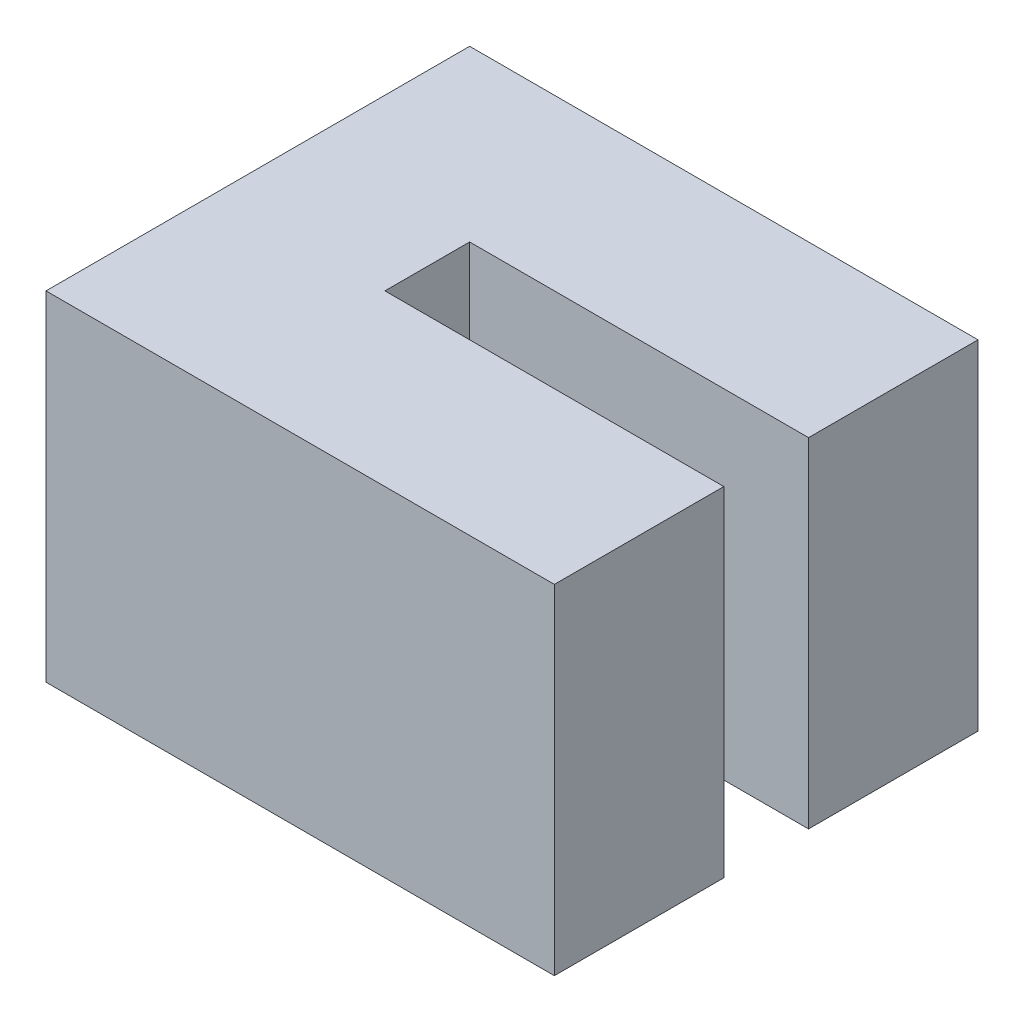
from build123d import *

# Parameters (mm, degrees)
BOSS_EXTRUDE1_DEPTH = 20


with BuildPart() as part:
    # Sketch1 → Boss-Extrude1 (new body)
    with BuildSketch(Plane(origin=(0, 0, 0), x_dir=(1, 0, 0), z_dir=(0, 1, 0))):
        Polygon((0, 0), (0, -25), (30, -25), (30, -15), (10, -15), (10, -10), (30, -10), (30, 0), align=None)
    extrude(amount=BOSS_EXTRUDE1_DEPTH)


solid = part.part
